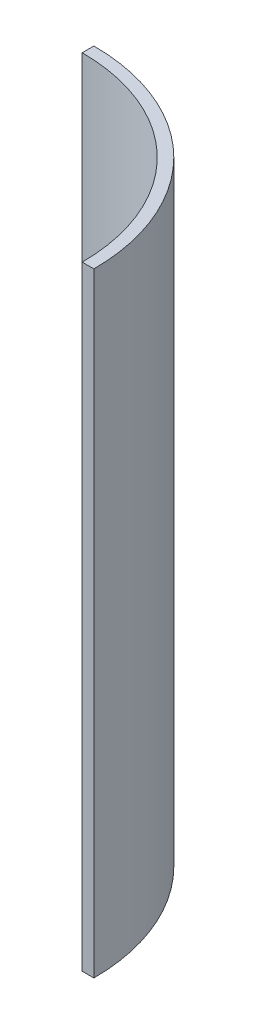
from build123d import *

# Parameters (mm, degrees)
SKETCH2_R           = 33
SKETCH2_R_2         = 31
BOSS_EXTRUDE2_DEPTH = 105
CUT_EXTRUDE1_DEPTH  = 110


with BuildPart() as part:
    # Sketch2 → Boss-Extrude2 (new body)
    with BuildSketch(Plane(origin=(0, 5, 0), x_dir=(1, 0, 0), z_dir=(0, 1, 0))):
        with Locations(Location((0, 0, 0), (0, 0, 270))):
            Circle(SKETCH2_R)
        with Locations(Location((0, 0, 0), (0, 0, 270))):
            Circle(SKETCH2_R_2, mode=Mode.SUBTRACT)
    extrude(amount=BOSS_EXTRUDE2_DEPTH)

    # Sketch3 → Cut-Extrude1 (cut)
    with BuildSketch(Plane(origin=(0, 115, 0), x_dir=(1, 0, 0), z_dir=(0, 1, 0))):
        with BuildLine():
            ThreePointArc((0, 35), (-24.748737342, -24.748737342), (35, 0))
            Line((35, 0), (0, 0))
            Line((0, 0), (0, 35))
        make_face()
    extrude(amount=-CUT_EXTRUDE1_DEPTH, mode=Mode.SUBTRACT)


solid = part.part
